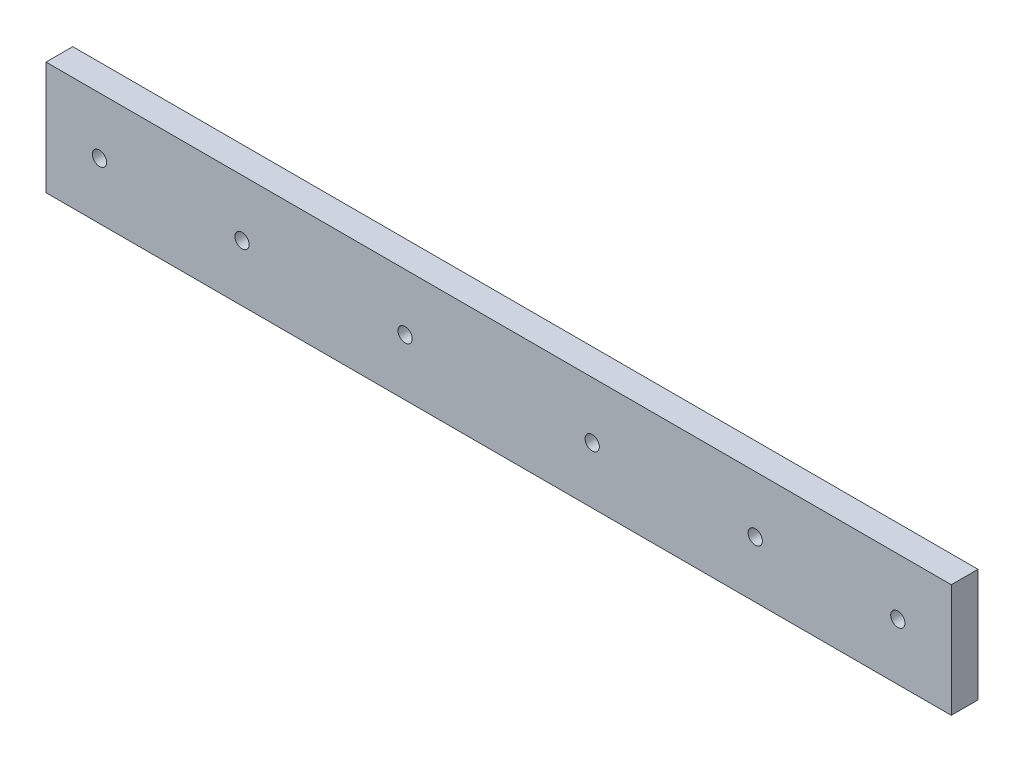
from build123d import *

# Parameters (mm, degrees)
ESQUISSE1_W        = 203.2
ESQUISSE1_H        = 25.4
BOSS_EXTRU_1_DEPTH = 6
D_GAGEMENT_M31_D   = 3.2


with BuildPart() as part:
    # Esquisse1 → Boss.-Extru.1 (new body)
    with BuildSketch(Plane.XY):
        Rectangle(ESQUISSE1_W, ESQUISSE1_H)
    extrude(amount=BOSS_EXTRU_1_DEPTH)

    # Dégagement M31 (through all)
    with Locations(Plane(origin=(89.6, 0, 6), x_dir=(1, 0, 0), z_dir=(0, 0, 1))):
        with Locations((0, 0), (-32, 0), (-68.6, 0), (-110.6, 0), (-147.2, 0), (-179.2, 0)):
            Hole(D_GAGEMENT_M31_D / 2)


solid = part.part
